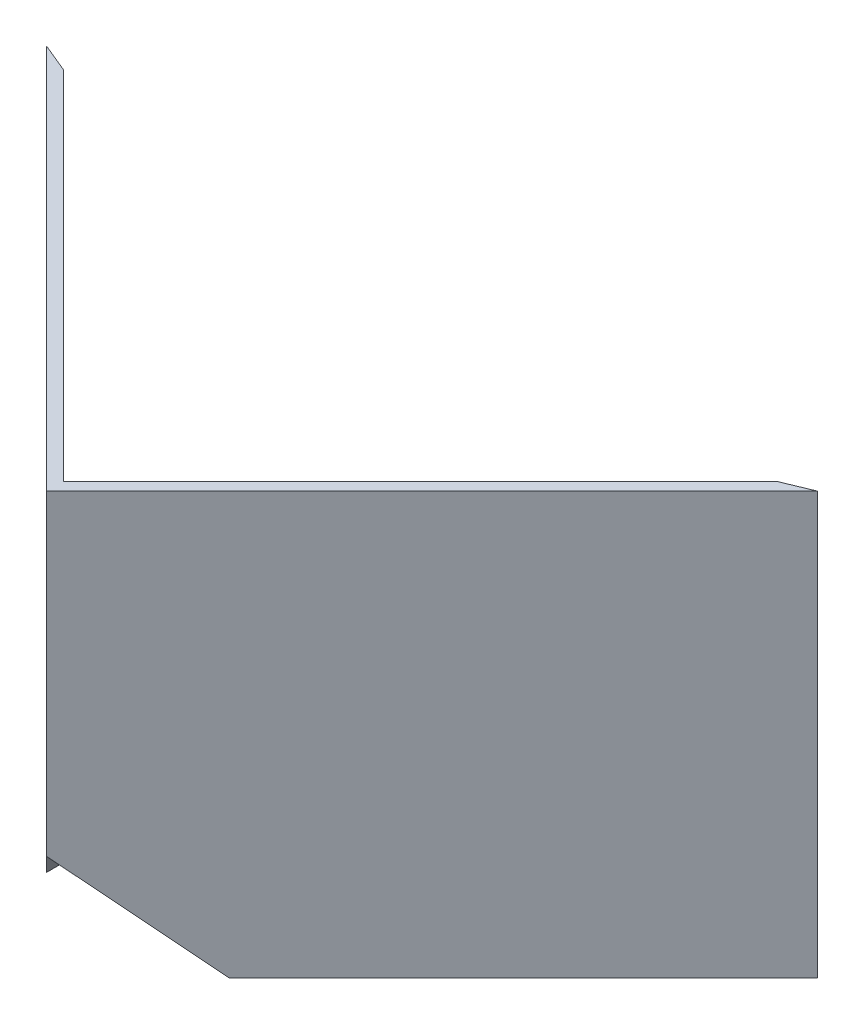
from build123d import *

# Parameters (mm, degrees)
BOSS_EXTRUDE1_DEPTH     = 35
CUT_EXTRUDE3_DEPTH      = 96.198576189
CUT_EXTRUDE3_DEPTH_BACK = 96.198576189


with BuildPart() as part:
    # Sketch1 → Boss-Extrude1 (new, symmetric)
    with BuildSketch(Plane(origin=(0, 0, 0), x_dir=(1, 0, 0), z_dir=(0, 1, 0))):
        Polygon((-1.105e-06, -61.171572908), (-59.171572937, -2), (-64, 0), (-1.131e-06, -64.000000033), (64.000000066, 0), (59.171572879, -2), align=None)
    extrude(amount=BOSS_EXTRUDE1_DEPTH, both=True)

    # Sketch4 → Cut-Extrude3 (cut, two sides: drawn at the far end of the back side and taken through both)
    with BuildSketch(Plane.XY.offset(61.17).offset(-CUT_EXTRUDE3_DEPTH_BACK)):
        Polygon((-15.180001131, -35), (15.179998869, -35), (-1.131e-06, -17.5), align=None)
    extrude(amount=CUT_EXTRUDE3_DEPTH + CUT_EXTRUDE3_DEPTH_BACK, mode=Mode.SUBTRACT)


solid = part.part
